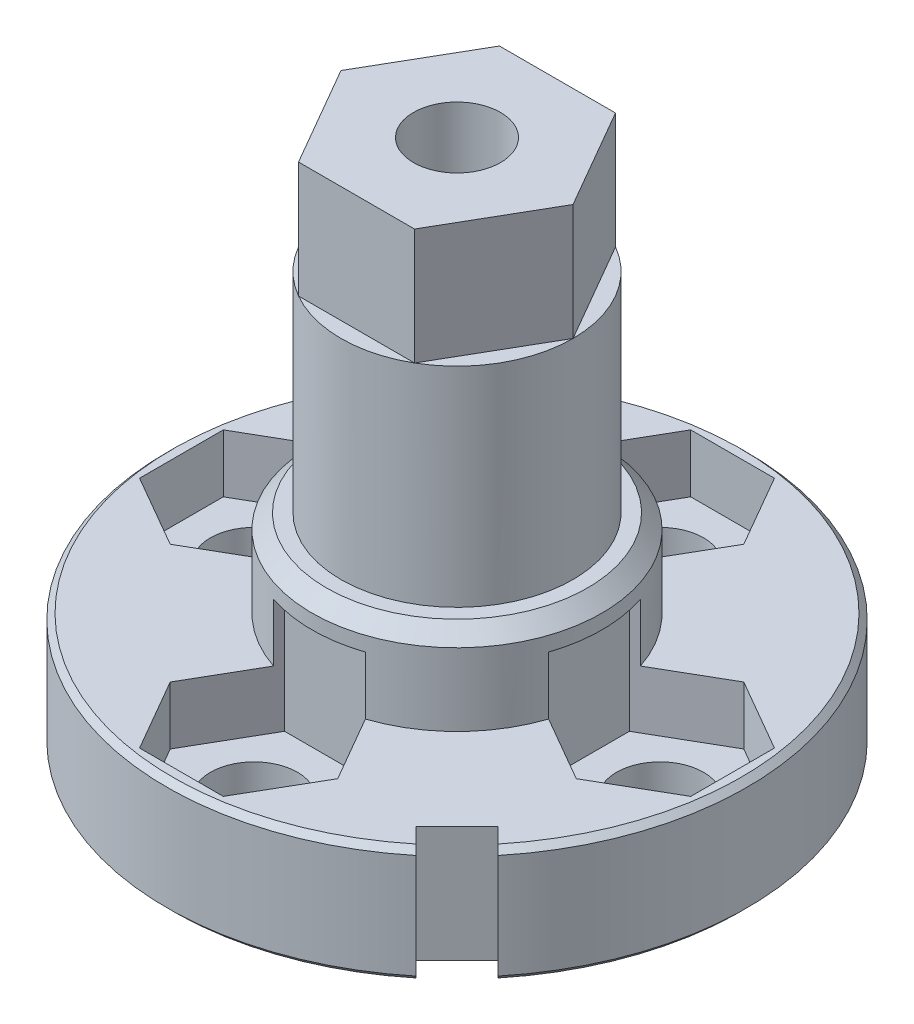
from build123d import *

# Parameters (mm, degrees)
SKETCH1_R           = 4
BOSS_EXTRUDE1_DEPTH = 7.2
BOSS_EXTRUDE2_DEPTH = 4
SKETCH3_R           = 5
BOSS_EXTRUDE3_DEPTH = 3
CHAMFER1_SIZE       = 0.5
SKETCH4_R           = 10
BOSS_EXTRUDE4_DEPTH = 4
CHAMFER2_SIZE       = 0.2
SKETCH5_R           = 1.5
CUT_EXTRUDE1_DEPTH  = 24.048644212
SKETCH6_R           = 1.5
CUT_EXTRUDE2_DEPTH  = 4
SKETCH7_R           = 1.5
CUT_EXTRUDE3_DEPTH  = 4
CUT_EXTRUDE4_START  = -2
SKETCH7_3_R         = 1.5
CUT_EXTRUDE4_DEPTH  = 4
CUT_EXTRUDE5_DEPTH  = 5
CUT_EXTRUDE6_DEPTH  = 10


with BuildPart() as part:
    # Sketch1 → Boss-Extrude1 (new body)
    with BuildSketch(Plane(origin=(0, 0, 0), x_dir=(1, 0, 0), z_dir=(0, 1, 0))):
        Circle(SKETCH1_R)
    extrude(amount=BOSS_EXTRUDE1_DEPTH)

    # Sketch2 → Boss-Extrude2 (add)
    with BuildSketch(Plane(origin=(0, 7.2, 0), x_dir=(1, 0, 0), z_dir=(0, 1, 0))):
        Polygon((4, 0), (2, 3.464101615), (-2, 3.464101615), (-4, 0), (-2, -3.464101615), (2, -3.464101615), align=None)
    extrude(amount=BOSS_EXTRUDE2_DEPTH)

    # Sketch3 → Boss-Extrude3 (add)
    with BuildSketch(Plane.XZ):
        Circle(SKETCH3_R)
    extrude(amount=BOSS_EXTRUDE3_DEPTH)

    # Chamfer1
    chamfer1_edges = [part.edges().sort_by_distance(p)[0] for p in [
        (-5, 0, 0),
    ]]
    chamfer(chamfer1_edges, length=CHAMFER1_SIZE)

    # Sketch4 → Boss-Extrude4 (add)
    with BuildSketch(Plane.XZ.offset(3)):
        Circle(SKETCH4_R)
    extrude(amount=BOSS_EXTRUDE4_DEPTH)

    # Chamfer2
    chamfer2_edges = [part.edges().sort_by_distance(p)[0] for p in [
        (-10, -7, 0),
        (-10, -3, 0),
    ]]
    chamfer(chamfer2_edges, length=CHAMFER2_SIZE)

    # Sketch5 → Cut-Extrude1 (cut, through all)
    with BuildSketch(Plane.XZ.offset(7)):
        Circle(SKETCH5_R)
    extrude(amount=-CUT_EXTRUDE1_DEPTH, mode=Mode.SUBTRACT)

    # Sketch6 → Cut-Extrude2 (cut)
    with BuildSketch(Plane.XZ.offset(7)):
        Polygon((4, 0), (2, 3.464101615), (-2, 3.464101615), (-4, 0), (-2, -3.464101615), (2, -3.464101615), align=None)
        Circle(SKETCH6_R, mode=Mode.SUBTRACT)
    extrude(amount=-CUT_EXTRUDE2_DEPTH, mode=Mode.SUBTRACT)

    # Sketch7 → Cut-Extrude3 (cut)
    with BuildSketch(Plane.XZ.offset(7)):
        with Locations((-7, 0)):
            Circle(SKETCH7_R)
        with Locations((0, 7)):
            Circle(SKETCH7_R)
        with Locations((7, 0)):
            Circle(SKETCH7_R)
        with Locations((0, -7)):
            Circle(SKETCH7_R)
    extrude(amount=-CUT_EXTRUDE3_DEPTH, mode=Mode.SUBTRACT)

    # Sketch7<3> → Cut-Extrude4 (cut)
    # profile 1 of 4: a face of its own
    with BuildSketch(Plane.XZ.offset(7).offset(CUT_EXTRUDE4_START)):
        Polygon((1.443375673, 4.5), (2.886751346, 7), (1.443375673, 9.5), (-1.443375673, 9.5), (-2.886751346, 7), (-1.443375673, 4.5), align=None)
        with Locations((0, 7)):
            Circle(SKETCH7_3_R, mode=Mode.SUBTRACT)
    # profile 2 of 4: a face of its own
    with BuildSketch(Plane.XZ.offset(7).offset(CUT_EXTRUDE4_START)):
        Polygon((-4.5, 1.443375673), (-7, 2.886751346), (-9.5, 1.443375673), (-9.5, -1.443375673), (-7, -2.886751346), (-4.5, -1.443375673), align=None)
        with Locations((-7, 0)):
            Circle(SKETCH7_3_R, mode=Mode.SUBTRACT)
    # profile 3 of 4: a face of its own
    with BuildSketch(Plane.XZ.offset(7).offset(CUT_EXTRUDE4_START)):
        Polygon((4.5, -1.443375673), (7, -2.886751346), (9.5, -1.443375673), (9.5, 1.443375673), (7, 2.886751346), (4.5, 1.443375673), align=None)
        with Locations((7, 0)):
            Circle(SKETCH7_3_R, mode=Mode.SUBTRACT)
    # profile 4 of 4: a face of its own
    with BuildSketch(Plane.XZ.offset(7).offset(CUT_EXTRUDE4_START)):
        Polygon((-1.443375673, -4.5), (-2.886751346, -7), (-1.443375673, -9.5), (1.443375673, -9.5), (2.886751346, -7), (1.443375673, -4.5), align=None)
        with Locations((0, -7)):
            Circle(SKETCH7_3_R, mode=Mode.SUBTRACT)
    extrude(amount=-CUT_EXTRUDE4_DEPTH, mode=Mode.SUBTRACT)

    # Sketch8 → Cut-Extrude5 (cut)
    with BuildSketch(Plane.XZ.offset(3)):
        Polygon((1.58771324, 2.75), (-1.58771324, 2.75), (-3.175426481, 0), (-1.58771324, -2.75), (1.58771324, -2.75), (3.175426481, 0), align=None)
    extrude(amount=-CUT_EXTRUDE5_DEPTH, mode=Mode.SUBTRACT)

    # Sketch9 → Cut-Extrude6 (cut)
    with BuildSketch(Plane.XZ.offset(7)):
        Polygon((8.485281374, 9.899494937), (5.656854249, 7.071067812), (7.071067812, 5.656854249), (9.899494937, 8.485281374), align=None)
    extrude(amount=-CUT_EXTRUDE6_DEPTH, mode=Mode.SUBTRACT)


solid = part.part
